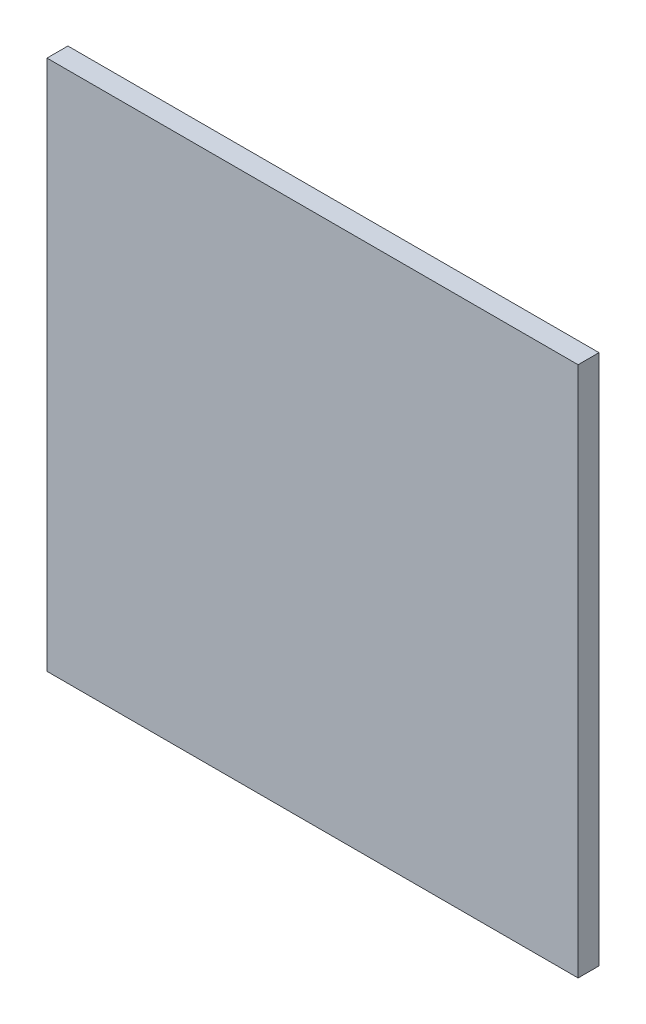
from build123d import *

# Parameters (mm, degrees)
SKETCH_1_W      = 76.2
SKETCH_1_H      = 76.2
EXTRUDE_1_DEPTH = 3


with BuildPart() as part:
    # 스케치1 → 보스-돌출1 (new body)
    with BuildSketch(Plane.XY):
        Rectangle(SKETCH_1_W, SKETCH_1_H)
    extrude(amount=EXTRUDE_1_DEPTH)


solid = part.part
